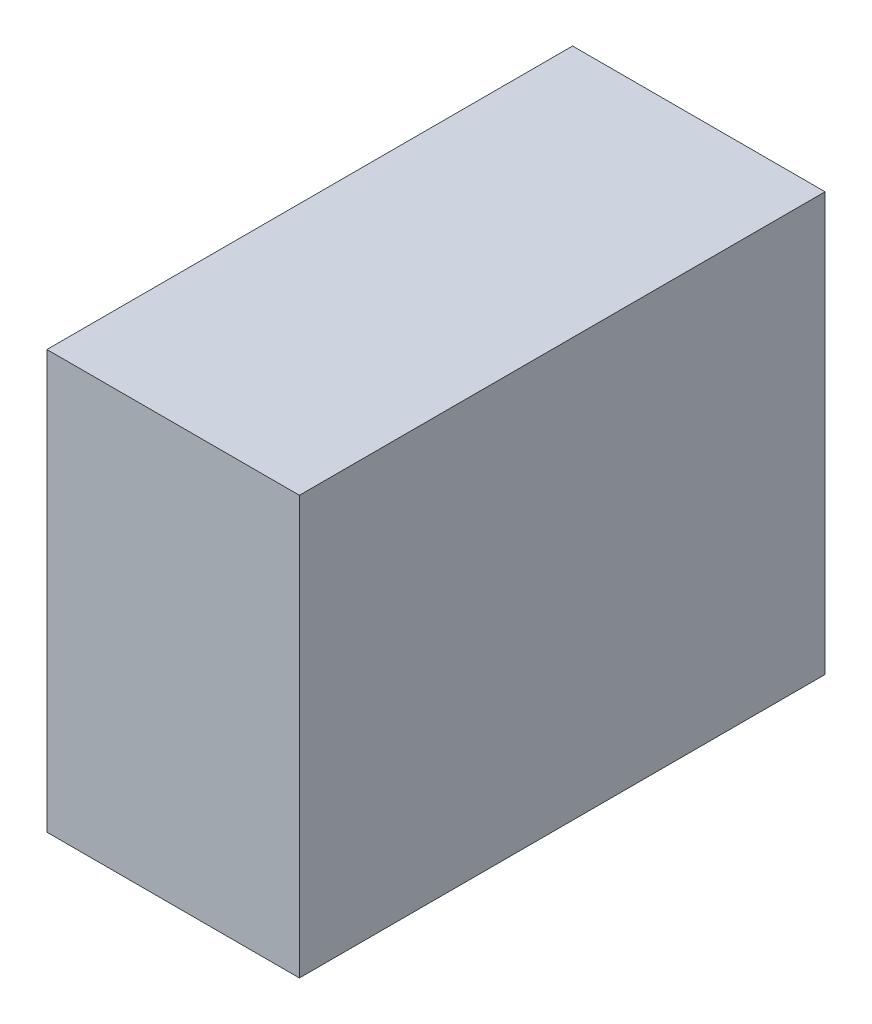
from build123d import *

# Parameters (mm, degrees)
SKETCH_1_W      = 5.05
SKETCH_1_H      = 3.05
EXTRUDE_1_DEPTH = 6.35


with BuildPart() as part:
    # ｽｹｯﾁ1 → ﾎﾞｽ - 押し出し1 (new body)
    with BuildSketch(Plane(origin=(0, 0, 0), x_dir=(0, 1, 0), z_dir=(0, 0, 1))):
        with Locations((0, 1.525)):
            Rectangle(SKETCH_1_W, SKETCH_1_H)
    extrude(amount=EXTRUDE_1_DEPTH)


solid = part.part
